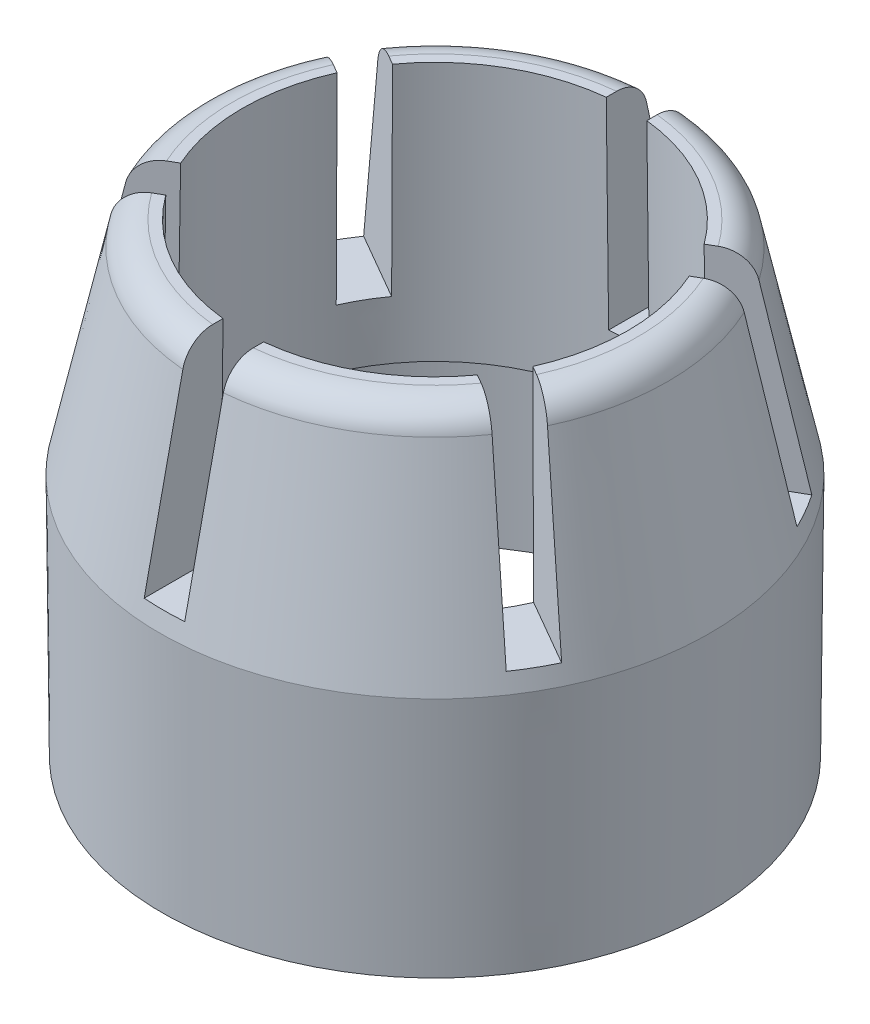
from build123d import *

# Parameters (mm, degrees)
SKETCH3_W          = 2
SKETCH3_H          = 10.621146273
CUT_EXTRUDE1_DEPTH = 10
CIRPATTERN1_COUNT  = 6


with BuildPart() as part:
    # Sketch1 → Revolve1 (revolve)
    with BuildSketch(Plane.XY, mode=Mode.PRIVATE) as revolve1_sk:
        with BuildLine():
            Line((12.7, -3.253426841), (13.447114034, -3.253426841))
            Line((13.447114034, -3.253426841), (13.563291986, 8.746573159))
            Line((13.563291986, 8.746573159), (11.473793749, 18.442570525))
            ThreePointArc((11.473793749, 18.442570525), (10.949794816, 19.29361987), (10.007456249, 19.626573159))
            Line((10.007456249, 19.626573159), (9.5, 19.626573159))
            Line((9.5, 19.626573159), (9.65, 6.746573159))
            Line((9.65, 6.746573159), (12.7, 6.746573159))
            Line((12.7, 6.746573159), (12.7, -3.253426841))
        make_face()
    revolve(revolve1_sk.sketch.rotate(Axis((0, 0, 0), (0, 1, 0)), 90), axis=Axis((0, 0, 0), (0, 1, 0)))

    # Sketch3 → Cut-Extrude1 (cut)
    with BuildSketch(Plane(origin=(0, 19.626573159, 0), x_dir=(1, 0, 0), z_dir=(0, 1, 0))):
        with Locations((0, 10.007456249)):
            Rectangle(SKETCH3_W, SKETCH3_H)
    cut_extrude1 = extrude(amount=-CUT_EXTRUDE1_DEPTH, mode=Mode.SUBTRACT)

    # CirPattern1: Cut-Extrude1 ×6 about axis
    cirpattern1_axis = Axis((0, 0, 0), (0, 1, 0))
    for i in range(1, CIRPATTERN1_COUNT):
        add(cut_extrude1.rotate(cirpattern1_axis, i * 360 / CIRPATTERN1_COUNT), mode=Mode.SUBTRACT)


solid = part.part
